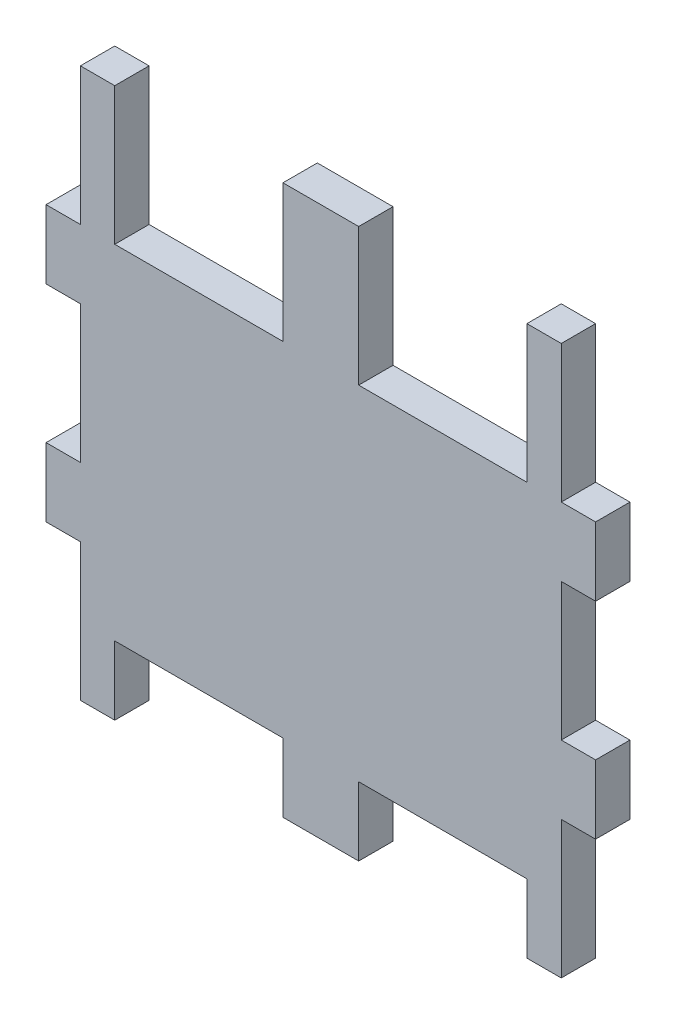
from build123d import *

# Parameters (mm, degrees)
SKETCH2_W           = 101.6
SKETCH2_H           = 101.6
BOSS_EXTRUDE3_DEPTH = 6.35
SKETCH3_W           = 6.35
SKETCH3_H           = 25.4
SKETCH3_W_2         = 31.1
SKETCH3_W_3         = 31.100053481
SKETCH3_W_4         = 6.34997326
SKETCH3_H_2         = 25.400000079
SKETCH3_H_3         = 25.399999921
SKETCH3_W_5         = 31.100486926
SKETCH3_H_4         = 12.7
CUT_EXTRUDE1_DEPTH  = 73.122135992


with BuildPart() as part:
    # Sketch2 → Boss-Extrude3 (new body)
    with BuildSketch(Plane.XY):
        Rectangle(SKETCH2_W, SKETCH2_H)
    extrude(amount=BOSS_EXTRUDE3_DEPTH)

    # Sketch3 → Cut-Extrude1 (cut, through all)
    with BuildSketch(Plane.XY.offset(6.35)):
        with Locations((-47.625, 38.1)):
            Rectangle(SKETCH3_W, SKETCH3_H)
        with Locations((-22.55, 38.1)):
            Rectangle(SKETCH3_W_2, SKETCH3_H)
        with Locations((-47.625, 0)):
            Rectangle(SKETCH3_W, SKETCH3_H)
        with Locations((22.550026741, 38.1)):
            Rectangle(SKETCH3_W_3, SKETCH3_H)
        with Locations((-47.625, -38.1)):
            Rectangle(SKETCH3_W, SKETCH3_H)
        with Locations((47.62501337, 38.1)):
            Rectangle(SKETCH3_W_4, SKETCH3_H)
        with Locations((47.62501337, -3.9e-08)):
            Rectangle(SKETCH3_W_4, SKETCH3_H_2)
        Polygon((-7.000486295, -38.1), (-38.1, -38.1), (-38.1, -50.8), (-6.999486151, -50.8), align=None)
        with Locations((47.62501337, -38.10000004)):
            Rectangle(SKETCH3_W_4, SKETCH3_H_3)
        with Locations((22.549757168, -44.45)):
            Rectangle(SKETCH3_W_5, SKETCH3_H_4)
    extrude(amount=-CUT_EXTRUDE1_DEPTH, mode=Mode.SUBTRACT)


solid = part.part
